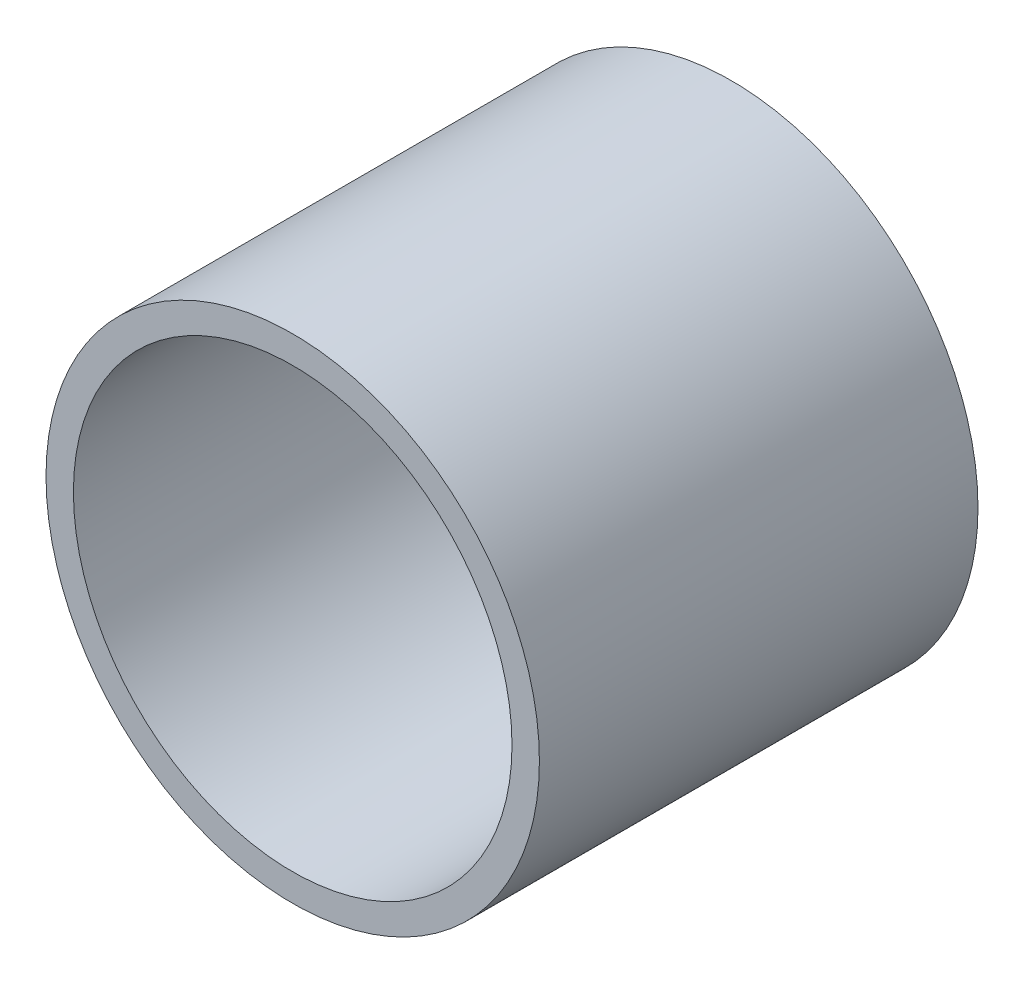
from build123d import *

# Parameters (mm, degrees)
SKETCH1_R           = 4.5
SKETCH1_R_2         = 4
BOSS_EXTRUDE1_DEPTH = 8


with BuildPart() as part:
    # Sketch1 → Boss-Extrude1 (new body)
    with BuildSketch(Plane.XY):
        Circle(SKETCH1_R)
        Circle(SKETCH1_R_2, mode=Mode.SUBTRACT)
    extrude(amount=BOSS_EXTRUDE1_DEPTH)


solid = part.part
